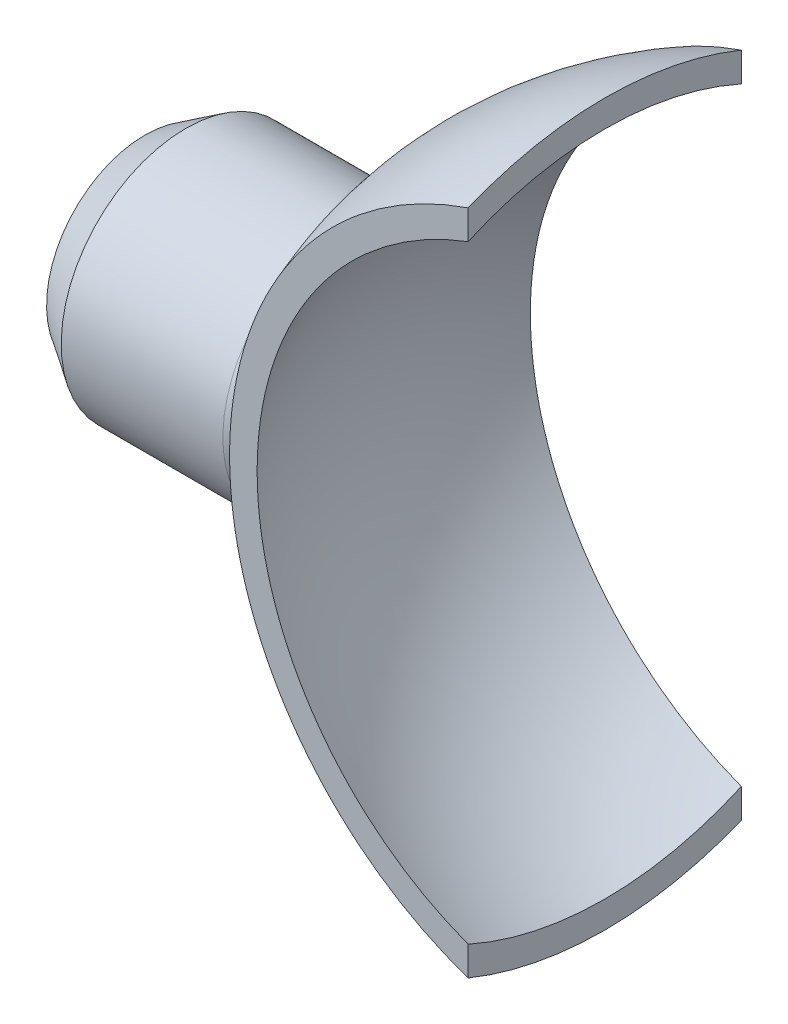
from build123d import *

# Parameters (mm, degrees)
KES_EKSTR_ZYON1_DEPTH = 18


with BuildPart() as part:
    # Çizim1 → Döndür3 (revolve)
    with BuildSketch(Plane.XY):
        with BuildLine():
            Line((-1.32512155, 2.139611708), (-1.32512155, 0.570301782))
            Line((-1.32512155, 0.570301782), (-0.411194993, 0.570301782))
            ThreePointArc((-0.411194993, 0.570301782), (-0.422380451, 0.285248389), (-0.426109787, 0))
            Line((-0.426109787, 0), (0, 0))
            ThreePointArc((0, 0), (1.957189595, 6.100058308), (7.098060997, 9.922720168))
            Line((7.098060997, 9.922720168), (7.098060997, 10.723199249))
            ThreePointArc((7.098060997, 10.723199249), (2.598216191, 8.016184499), (-0.181803757, 3.56107269))
            ThreePointArc((-0.181803757, 3.56107269), (-0.35786127, 3.666258696), (-0.558844205, 3.707077853))
            Line((-0.558844205, 3.707077853), (-5.367482514, 3.707077853))
            Line((-5.367482514, 3.707077853), (-6.581672956, 2.928819663))
            Line((-6.581672956, 2.928819663), (-6.581672956, 2.145222918))
            Line((-6.581672956, 2.145222918), (-1.32512155, 2.139611708))
        make_face()
    revolve(axis=Axis((0, 0, 0), (-1, 0, 0)))

    # Çizim2 → Kes-Ekstrüzyon1 (cut)
    with BuildSketch(Plane.ZY.offset(6.581672956)):
        Polygon((-4.065, 0), (-4.065, 9.922841183), (-12.277622452, 10.110434639), (-12.277622452, -10.854234794), (-4.065, -10.854234794), align=None)
        Polygon((4.065, 0), (4.065, 10.512736346), (12.14810156, 10.512736346), (12.606032623, -11.349214468), (4.065, -11.349214468), align=None)
    extrude(amount=-KES_EKSTR_ZYON1_DEPTH, mode=Mode.SUBTRACT)


solid = part.part
